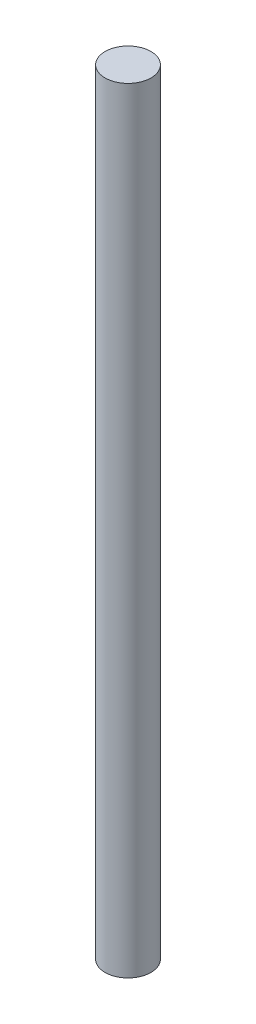
from build123d import *

# Parameters (mm, degrees)
SKETCH1_R           = 3
BOSS_EXTRUDE1_DEPTH = 54
SKETCH2_R           = 3
BOSS_EXTRUDE2_DEPTH = 35.293714059
SKETCH3_R           = 3
BOSS_EXTRUDE3_DEPTH = 6
BOSS_EXTRUDE4_START = 6
SKETCH4_R           = 3
BOSS_EXTRUDE4_DEPTH = 6


with BuildPart() as part:
    # Sketch1 → Boss-Extrude1 (new body)
    with BuildSketch(Plane(origin=(0, 0, 0), x_dir=(1, 0, 0), z_dir=(0, 1, 0))):
        with Locations(Location((0, 0, 0), (0, 0, 270))):
            Circle(SKETCH1_R)
    extrude(amount=BOSS_EXTRUDE1_DEPTH)

    # Sketch2 → Boss-Extrude2 (add)
    with BuildSketch(Plane(origin=(0, 54, 0), x_dir=(1, 0, 0), z_dir=(0, 1, 0))):
        with Locations(Location((0, 0, 0), (0, 0, 270))):
            Circle(SKETCH2_R)
    extrude(amount=BOSS_EXTRUDE2_DEPTH)

    # Sketch3 → Boss-Extrude3 (add)
    with BuildSketch(Plane(origin=(0, 89.293714059, 0), x_dir=(1, 0, 0), z_dir=(0, 1, 0))):
        with Locations(Location((0, 0, 0), (0, 0, 270))):
            Circle(SKETCH3_R)
    extrude(amount=BOSS_EXTRUDE3_DEPTH)

    # Sketch4 → Boss-Extrude4 (add)
    with BuildSketch(Plane.XZ.offset(BOSS_EXTRUDE4_START)):
        with Locations(Location((0, 0, 0), (0, 0, 270))):
            Circle(SKETCH4_R)
    extrude(amount=-BOSS_EXTRUDE4_DEPTH)


solid = part.part
